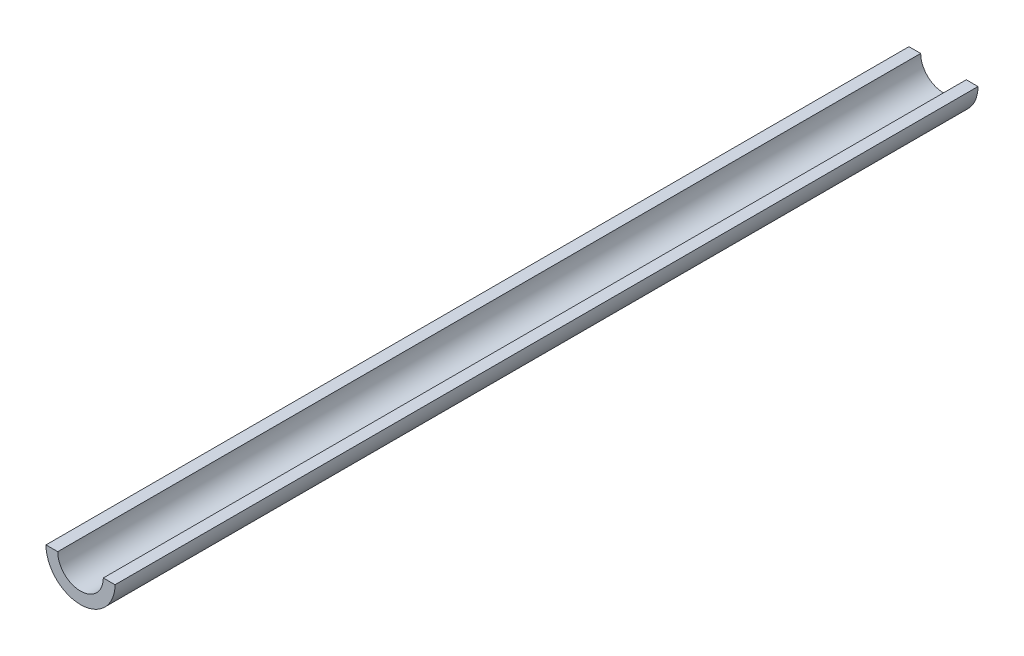
from build123d import *

# Parameters (mm, degrees)
EXTRUDE_1_DEPTH = 250


with BuildPart() as part:
    # 草图1 → 凸台-拉伸1 (new body)
    with BuildSketch(Plane.XY):
        with BuildLine():
            Line((6.6, 0), (10, 0))
            ThreePointArc((10, 0), (0, -10), (-10, 0))
            Line((-10, 0), (-6.6, 0))
            ThreePointArc((-6.6, 0), (0, -6.6), (6.6, 0))
        make_face()
    extrude(amount=EXTRUDE_1_DEPTH)


solid = part.part
